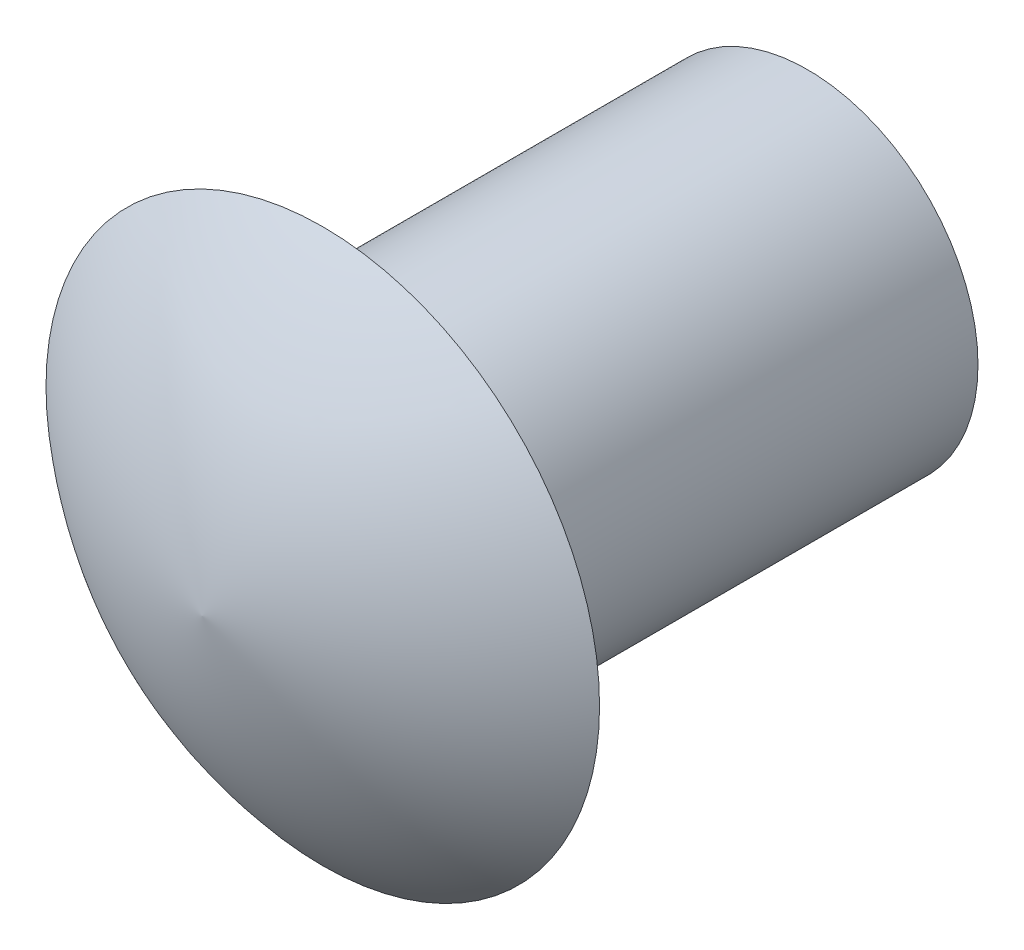
from build123d import *

# Parameters (mm, degrees)
SKETCH1_R      = 11.16457
EXTRUDE1_DEPTH = 31.75


with BuildPart() as part:
    # Sketch1 → Extrude1 (new body)
    with BuildSketch(Plane.XY):
        Circle(SKETCH1_R)
    extrude(amount=-EXTRUDE1_DEPTH)

    # Sketch2 → Revolve1 (revolve)
    with BuildSketch(Plane(origin=(0, 0, 0), x_dir=(0, 0, -1), z_dir=(1, 0, 0))):
        with BuildLine():
            Line((0, 0), (0, 18.128147655))
            ThreePointArc((0, 18.128147655), (-5.320784248, 9.661386296), (-7.900398126, 0))
            Line((-7.900398126, 0), (0, 0))
        make_face()
    revolve(axis=Axis((0, 0, 0), (0, 0, 1)))


solid = part.part
